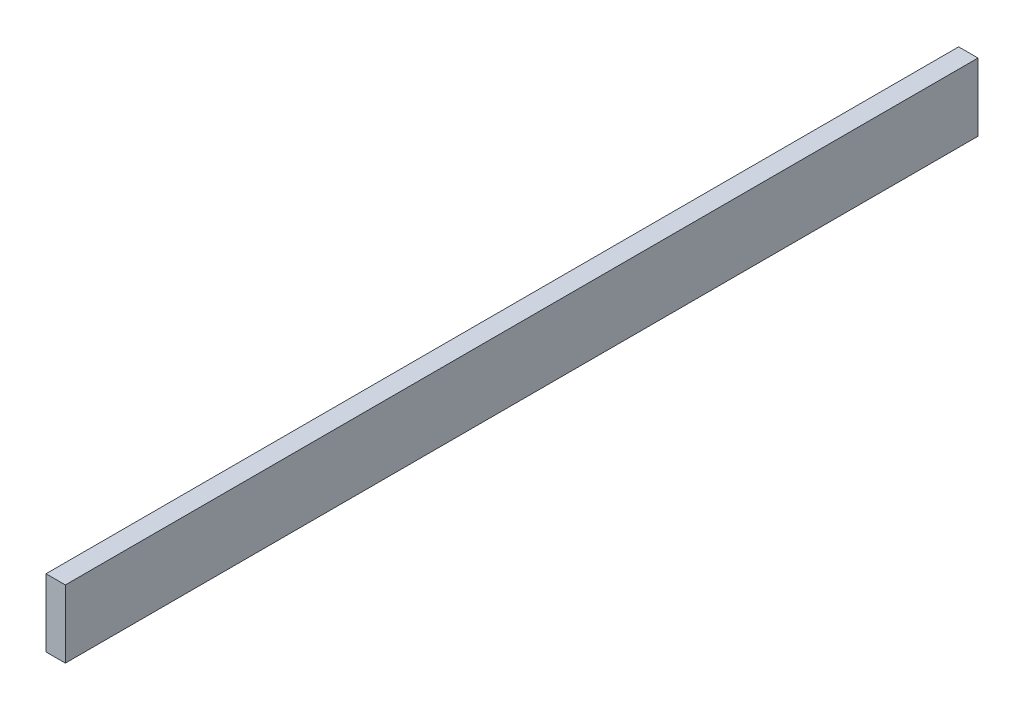
from build123d import *

# Parameters (mm, degrees)
SKETCH1_W                       = 14
SKETCH1_H                       = 49
DET2_RAY_DIS_PROFIL_SOL_1_DEPTH = 660


with BuildPart() as part:
    # Sketch1 → DET2_ray_dis_profil_sol_1 (new body)
    with BuildSketch(Plane.XY):
        with Locations((721, 1552.5)):
            Rectangle(SKETCH1_W, SKETCH1_H)
    extrude(amount=-DET2_RAY_DIS_PROFIL_SOL_1_DEPTH)


solid = part.part
